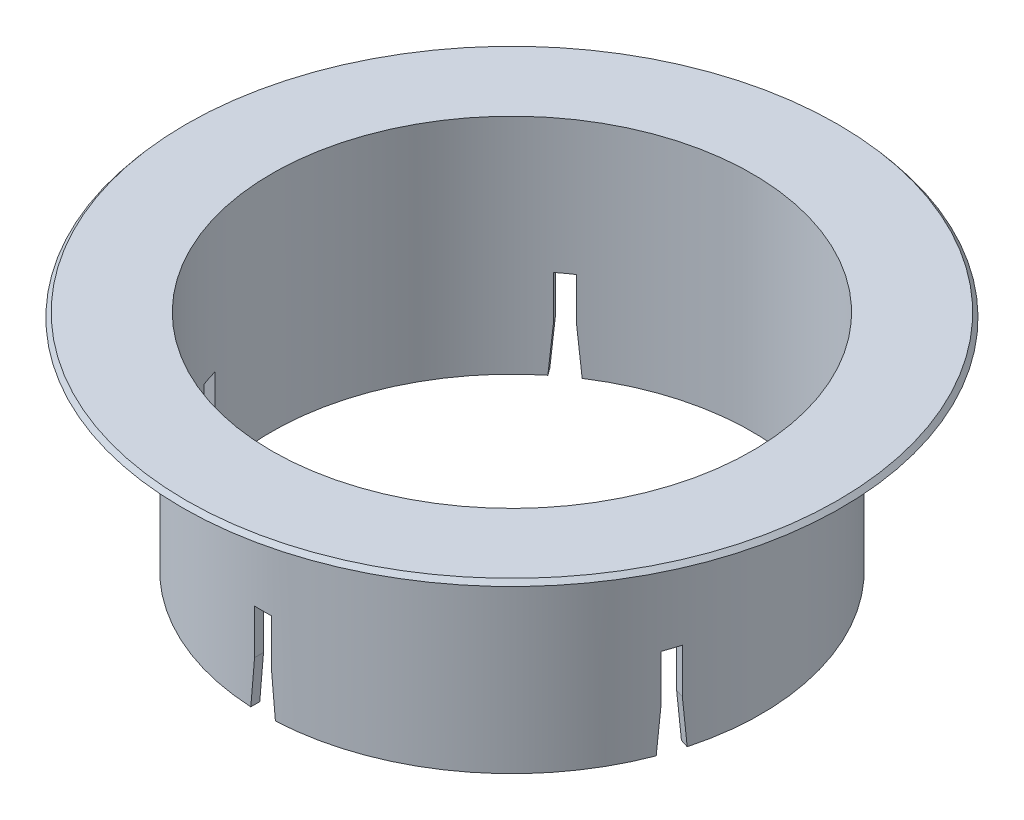
from build123d import *
from OCP.BRepFilletAPI import BRepFilletAPI_MakeChamfer

# Parameters (mm, degrees)
SKETCH2_W                     = 1.5
SKETCH2_H                     = 0.813085377
CUT_EXTRUDE1_DEPTH            = 8
CHAMFER1_SIZE                 = 4
CHAMFER1_SIZE2                = 0.349954654
CIRPATTERN1_COUNT             = 5
CHAMFER1_OF_CIRPATTERN1_SIZE  = 4
CHAMFER1_OF_CIRPATTERN1_SIZE2 = 0.349954654


with BuildPart() as part:
    # Sketch1 → Revolve1 (revolve)
    with BuildSketch(Plane(origin=(0, 0, 0), x_dir=(0, 0, -1), z_dir=(1, 0, 0))):
        Polygon((21.5, -20), (21.5, 0), (29.164360148, 0), (29.5, -0.4), (26.1, -1.4), (26.1, -0.4), (22.3, -0.4), (22.3, -20), align=None)
    revolve(axis=Axis((0, 64.33779776, 0), (0, -1, 0)))

    # Sketch2 → Cut-Extrude1 (cut)
    with BuildSketch(Plane.XZ.offset(20)):
        with Locations((0, 21.893457312)):
            Rectangle(SKETCH2_W, SKETCH2_H)
    cut_extrude1 = extrude(amount=-CUT_EXTRUDE1_DEPTH, mode=Mode.SUBTRACT)

    # Chamfer1: one chamfer whose edges measure the first distance from different faces: ONE call of the kernel's chamfer builder (chamfer() names one face for all edges)
    chamfer1_edges_1 = [part.edges().sort_by_distance(p)[0] for p in [
        (-0.75, -20, 21.887149473),
    ]]
    chamfer1_side_1 = [part.faces().sort_by_distance(p)[0] for p in [
        (-0.75, -16, 21.887149473),
    ]]
    chamfer1_edges_2 = [part.edges().sort_by_distance(p)[0] for p in [
        (0.75, -20, 21.887149473),
    ]]
    chamfer1_side_2 = [part.faces().sort_by_distance(p)[0] for p in [
        (0.75, -16, 21.887149473),
    ]]
    chamfer1 = BRepFilletAPI_MakeChamfer(part.part.solid().wrapped)
    for e in chamfer1_edges_1:
        chamfer1.Add(CHAMFER1_SIZE, CHAMFER1_SIZE2, e.wrapped, chamfer1_side_1[0].wrapped)  # the first distance lies on this face
    for e in chamfer1_edges_2:
        chamfer1.Add(CHAMFER1_SIZE, CHAMFER1_SIZE2, e.wrapped, chamfer1_side_2[0].wrapped)  # the first distance lies on this face
    add(Compound.cast(chamfer1.Shape()), mode=Mode.REPLACE)

    # CirPattern1: Cut-Extrude1 ×5 about axis
    cirpattern1_axis = Axis((0, 64.33779776, 0), (0, -1, 0))
    for i in range(1, CIRPATTERN1_COUNT):
        add(cut_extrude1.rotate(cirpattern1_axis, i * 360 / CIRPATTERN1_COUNT), mode=Mode.SUBTRACT)

    # Chamfer1 of CirPattern1: one chamfer whose edges measure the first distance from different faces: ONE call of the kernel's chamfer builder (chamfer() names one face for all edges)
    chamfer1_of_cirpattern1_edges_1 = [part.edges().sort_by_distance(p)[0] for p in [
        (-21.047678875, -20, 6.050208758),
    ]]
    chamfer1_of_cirpattern1_side_1 = [part.faces().sort_by_distance(p)[0] for p in [
        (-21.047678875, -16, 6.050208758),
    ]]
    chamfer1_of_cirpattern1_edges_2 = [part.edges().sort_by_distance(p)[0] for p in [
        (-20.584153384, -20, 7.476793533),
    ]]
    chamfer1_of_cirpattern1_side_2 = [part.faces().sort_by_distance(p)[0] for p in [
        (-20.584153384, -16, 7.476793533),
    ]]
    chamfer1_of_cirpattern1_edges_3 = [part.edges().sort_by_distance(p)[0] for p in [
        (-12.258180929, -20, -18.147914822),
    ]]
    chamfer1_of_cirpattern1_side_3 = [part.faces().sort_by_distance(p)[0] for p in [
        (-12.258180929, -16, -18.147914822),
    ]]
    chamfer1_of_cirpattern1_edges_4 = [part.edges().sort_by_distance(p)[0] for p in [
        (-13.471706421, -20, -17.266236943),
    ]]
    chamfer1_of_cirpattern1_side_4 = [part.faces().sort_by_distance(p)[0] for p in [
        (-13.471706421, -16, -17.266236943),
    ]]
    chamfer1_of_cirpattern1_edges_5 = [part.edges().sort_by_distance(p)[0] for p in [
        (13.471706421, -20, -17.266236943),
    ]]
    chamfer1_of_cirpattern1_side_5 = [part.faces().sort_by_distance(p)[0] for p in [
        (13.471706421, -16, -17.266236943),
    ]]
    chamfer1_of_cirpattern1_edges_6 = [part.edges().sort_by_distance(p)[0] for p in [
        (12.258180929, -20, -18.147914822),
    ]]
    chamfer1_of_cirpattern1_side_6 = [part.faces().sort_by_distance(p)[0] for p in [
        (12.258180929, -16, -18.147914822),
    ]]
    chamfer1_of_cirpattern1_edges_7 = [part.edges().sort_by_distance(p)[0] for p in [
        (20.584153384, -20, 7.476793533),
    ]]
    chamfer1_of_cirpattern1_side_7 = [part.faces().sort_by_distance(p)[0] for p in [
        (20.584153384, -16, 7.476793533),
    ]]
    chamfer1_of_cirpattern1_edges_8 = [part.edges().sort_by_distance(p)[0] for p in [
        (21.047678875, -20, 6.050208758),
    ]]
    chamfer1_of_cirpattern1_side_8 = [part.faces().sort_by_distance(p)[0] for p in [
        (21.047678875, -16, 6.050208758),
    ]]
    chamfer1_of_cirpattern1 = BRepFilletAPI_MakeChamfer(part.part.solid().wrapped)
    for e in chamfer1_of_cirpattern1_edges_1:
        chamfer1_of_cirpattern1.Add(CHAMFER1_OF_CIRPATTERN1_SIZE, CHAMFER1_OF_CIRPATTERN1_SIZE2, e.wrapped, chamfer1_of_cirpattern1_side_1[0].wrapped)  # the first distance lies on this face
    for e in chamfer1_of_cirpattern1_edges_2:
        chamfer1_of_cirpattern1.Add(CHAMFER1_OF_CIRPATTERN1_SIZE, CHAMFER1_OF_CIRPATTERN1_SIZE2, e.wrapped, chamfer1_of_cirpattern1_side_2[0].wrapped)  # the first distance lies on this face
    for e in chamfer1_of_cirpattern1_edges_3:
        chamfer1_of_cirpattern1.Add(CHAMFER1_OF_CIRPATTERN1_SIZE, CHAMFER1_OF_CIRPATTERN1_SIZE2, e.wrapped, chamfer1_of_cirpattern1_side_3[0].wrapped)  # the first distance lies on this face
    for e in chamfer1_of_cirpattern1_edges_4:
        chamfer1_of_cirpattern1.Add(CHAMFER1_OF_CIRPATTERN1_SIZE, CHAMFER1_OF_CIRPATTERN1_SIZE2, e.wrapped, chamfer1_of_cirpattern1_side_4[0].wrapped)  # the first distance lies on this face
    for e in chamfer1_of_cirpattern1_edges_5:
        chamfer1_of_cirpattern1.Add(CHAMFER1_OF_CIRPATTERN1_SIZE, CHAMFER1_OF_CIRPATTERN1_SIZE2, e.wrapped, chamfer1_of_cirpattern1_side_5[0].wrapped)  # the first distance lies on this face
    for e in chamfer1_of_cirpattern1_edges_6:
        chamfer1_of_cirpattern1.Add(CHAMFER1_OF_CIRPATTERN1_SIZE, CHAMFER1_OF_CIRPATTERN1_SIZE2, e.wrapped, chamfer1_of_cirpattern1_side_6[0].wrapped)  # the first distance lies on this face
    for e in chamfer1_of_cirpattern1_edges_7:
        chamfer1_of_cirpattern1.Add(CHAMFER1_OF_CIRPATTERN1_SIZE, CHAMFER1_OF_CIRPATTERN1_SIZE2, e.wrapped, chamfer1_of_cirpattern1_side_7[0].wrapped)  # the first distance lies on this face
    for e in chamfer1_of_cirpattern1_edges_8:
        chamfer1_of_cirpattern1.Add(CHAMFER1_OF_CIRPATTERN1_SIZE, CHAMFER1_OF_CIRPATTERN1_SIZE2, e.wrapped, chamfer1_of_cirpattern1_side_8[0].wrapped)  # the first distance lies on this face
    add(Compound.cast(chamfer1_of_cirpattern1.Shape()), mode=Mode.REPLACE)


solid = part.part
